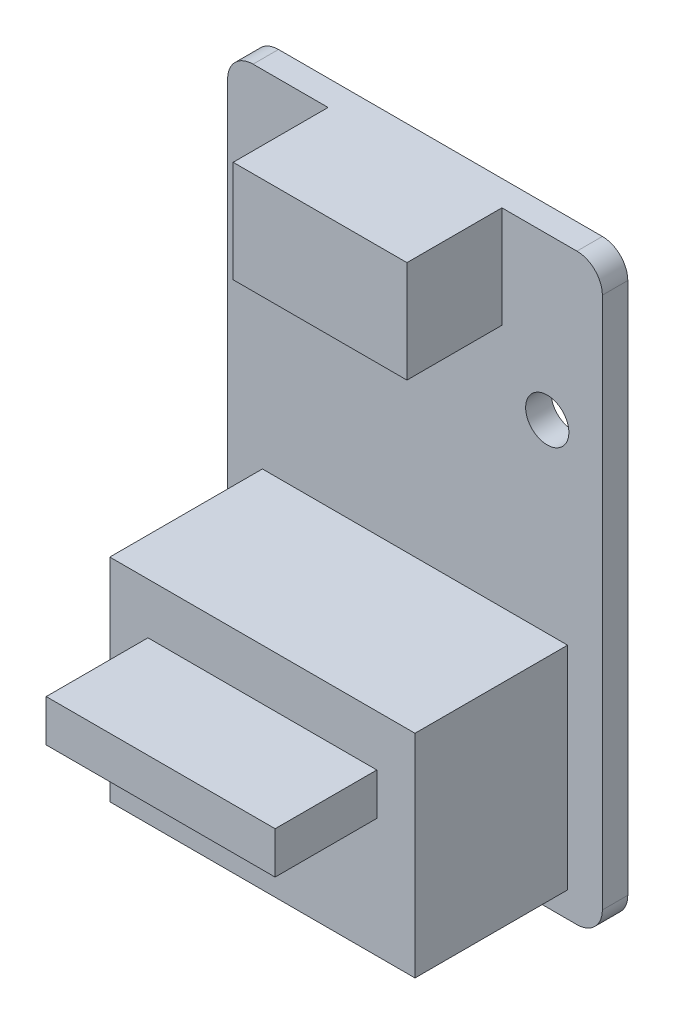
from build123d import *

# Parameters (mm, degrees)
EXTRUDE_1_DEPTH      = 1.5
SKETCH_2_W           = 18
SKETCH_2_H           = 12.5
EXTRUDE_2_DEPTH      = 9
SKETCH_3_W           = 13.5
SKETCH_3_H           = 2.47224136
EXTRUDE_3_DEPTH      = 6
SKETCH_4_W           = 10.25
SKETCH_4_H           = 6
EXTRUDE_4_DEPTH      = 5.6
HOLE_WIZARD_M2_5_1_D = 2.55


with BuildPart() as part:
    # 草圖1 → 填料-伸長1 (new body)
    with BuildSketch(Plane.XY):
        with BuildLine():
            Line((-6.760595539, -60.971994299), (12.339404461, -60.971994299))
            ThreePointArc((12.339404461, -60.971994299), (13.400064632, -61.411334127), (13.839404461, -62.471994299))
            Line((13.839404461, -62.471994299), (13.839404461, -93.871994299))
            ThreePointArc((13.839404461, -93.871994299), (13.400064632, -94.932654471), (12.339404461, -95.371994299))
            Line((12.339404461, -95.371994299), (-6.760595539, -95.371994299))
            ThreePointArc((-6.760595539, -95.371994299), (-7.821255711, -94.932654471), (-8.260595539, -93.871994299))
            Line((-8.260595539, -93.871994299), (-8.260595539, -62.471994299))
            ThreePointArc((-8.260595539, -62.471994299), (-7.821255711, -61.411334127), (-6.760595539, -60.971994299))
        make_face()
    extrude(amount=EXTRUDE_1_DEPTH)

    # 草圖2 → 填料-伸長2 (add)
    with BuildSketch(Plane.XY.offset(1.5)):
        with Locations((2.789404461, -87.621994299)):
            Rectangle(SKETCH_2_W, SKETCH_2_H)
    extrude(amount=EXTRUDE_2_DEPTH)

    # 草圖3 → 填料-伸長3 (add)
    with BuildSketch(Plane.XY.offset(10.5)):
        with Locations((2.789404461, -85.608114979)):
            Rectangle(SKETCH_3_W, SKETCH_3_H)
    extrude(amount=EXTRUDE_3_DEPTH)

    # 草圖4 → 填料-伸長4 (add)
    with BuildSketch(Plane.XY.offset(1.5)):
        with Locations((2.789404461, -63.971994299)):
            Rectangle(SKETCH_4_W, SKETCH_4_H)
    extrude(amount=EXTRUDE_4_DEPTH)

    # M2.5 螺旋的螺孔鑽1 (through all)
    with Locations(Plane.XY.offset(1.5)):
        with Locations((-5.010595539, -70.471994299), (10.589404461, -70.471994299)):
            Hole(HOLE_WIZARD_M2_5_1_D / 2)


solid = part.part
